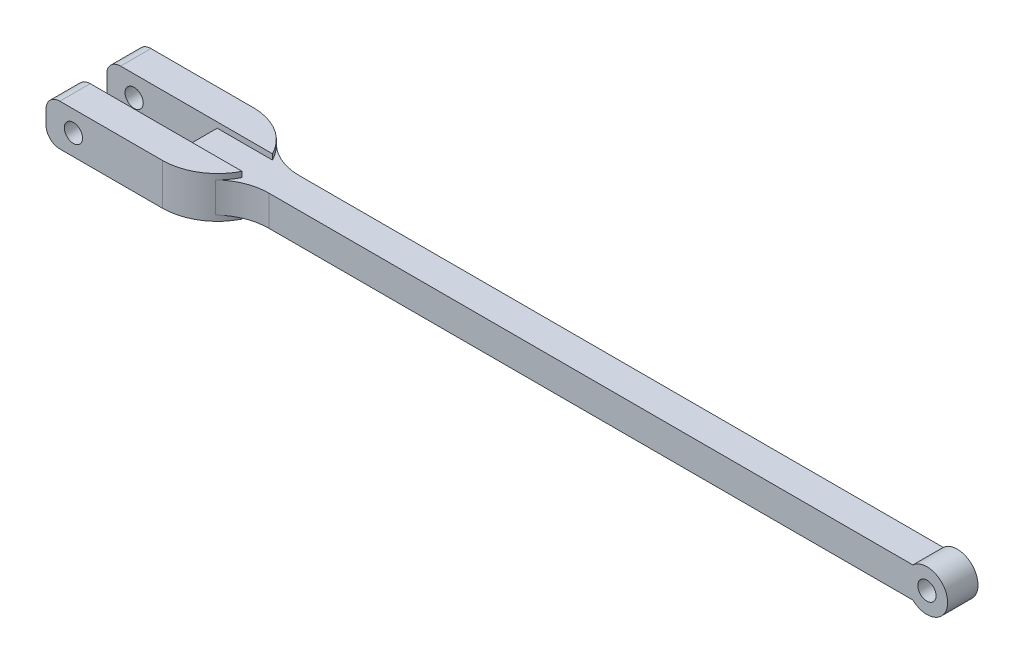
from build123d import *

# Parameters (mm, degrees)
BOSS_EXTRUDE1_DEPTH             = 213.36
BOSS_EXTRUDE1_DEPTH_BACK        = 127
SKETCH1_W                       = 13.97
SKETCH1_H                       = 14.012309452
BOSS_EXTRUDE2_REACH             = 215.589
SKETCH2_R                       = 9.525
BOSS_EXTRUDE2_DIRECTION_2_REACH = 215.589
CUT_EXTRUDE1_DEPTH              = 224.197757773
CUT_EXTRUDE1_DEPTH_BACK         = 224.197757773
SKETCH3_R                       = 4.191
BOSS_EXTRUDE3_DEPTH             = 9.525
FILLET1_R                       = 25.4
FILLET2_R                       = 25.4
FILLET5_R                       = 6.35
CUT_EXTRUDE4_DEPTH              = 225.070437307
CUT_EXTRUDE4_DEPTH_BACK         = 225.070437307
SKETCH10_R                      = 4.191


with BuildPart() as part:
    # Sketch1 → Boss-Extrude1 (new, two sides: drawn at the far end of the back side and taken through both)
    with BuildSketch(Plane(origin=(0, 0, 0), x_dir=(0, 0, -1), z_dir=(1, 0, 0)).offset(-BOSS_EXTRUDE1_DEPTH_BACK)):
        Rectangle(SKETCH1_W, SKETCH1_H)
    extrude(amount=BOSS_EXTRUDE1_DEPTH + BOSS_EXTRUDE1_DEPTH_BACK)

    # Boss-Extrude2: up to this face of the body (flat: up to its plane)
    boss_extrude2_end = Plane(part.part.faces().sort_by_distance((43.18, 0, 6.985))[0])
    # Sketch2 → Boss-Extrude2 (add, up to the picked face)
    with BuildSketch(Plane.XY, mode=Mode.PRIVATE) as boss_extrude2_sk1:
        with Locations((213.36, 0)):
            Circle(SKETCH2_R)
    boss_extrude2_tool1 = split(extrude(boss_extrude2_sk1.sketch, amount=BOSS_EXTRUDE2_REACH, mode=Mode.PRIVATE), bisect_by=boss_extrude2_end, keep=Keep.BOTH, mode=Mode.PRIVATE)
    add(boss_extrude2_tool1.solids().sort_by(Axis((213.36, 0, 0), (0, 0, 1)))[0])

    # Boss-Extrude2 direction 2: up to this face of the body (flat: up to its plane)
    boss_extrude2_direction_2_end = Plane(part.part.faces().sort_by_distance((43.18, 0, -6.985))[0])
    # Sketch2 → Boss-Extrude2 direction 2 (add, up to the picked face)
    with BuildSketch(Plane.XY, mode=Mode.PRIVATE) as boss_extrude2_direction_2_sk1:
        with Locations((213.36, 0)):
            Circle(SKETCH2_R)
    boss_extrude2_direction_2_tool1 = split(extrude(boss_extrude2_direction_2_sk1.sketch, amount=-BOSS_EXTRUDE2_DIRECTION_2_REACH, mode=Mode.PRIVATE), bisect_by=boss_extrude2_direction_2_end, keep=Keep.BOTH, mode=Mode.PRIVATE)
    add(boss_extrude2_direction_2_tool1.solids().sort_by(Axis((213.36, 0, 0), (0, 0, -1)))[0])

    # Sketch3 → Cut-Extrude1 (cut, two sides: drawn at the far end of the back side and taken through both)
    with BuildSketch(Plane.XY.offset(-CUT_EXTRUDE1_DEPTH_BACK)):
        with Locations((213.36, 0)):
            Circle(SKETCH3_R)
    extrude(amount=CUT_EXTRUDE1_DEPTH + CUT_EXTRUDE1_DEPTH_BACK, mode=Mode.SUBTRACT)

    # Sketch6 → Boss-Extrude3 (add, symmetric)
    with BuildSketch(Plane(origin=(0, 0, 0), x_dir=(1, 0, 0), z_dir=(0, 1, 0))):
        with BuildLine():
            Line((-127, 6.985), (-177.8, 6.985))
            Line((-177.8, 6.985), (-177.8, 20.955))
            Line((-177.8, 20.955), (-124.285401687, 20.955))
            ThreePointArc((-124.285401687, 20.955), (-110.964475014, 17.182372768), (-101.6, 6.985))
            Line((-101.6, 6.985), (-127, 6.985))
        make_face()
    boss_extrude3 = extrude(amount=BOSS_EXTRUDE3_DEPTH, both=True)

    # Fillet1
    fillet1_edges = [part.edges().sort_by_distance(p)[0] for p in [
        (-101.6, 0, -6.985),
    ]]
    fillet(fillet1_edges, radius=FILLET1_R)

    # Mirror3: Boss-Extrude3 across plane
    add(boss_extrude3.mirror(Plane.XY))

    # Fillet2
    fillet2_edges = [part.edges().sort_by_distance(p)[0] for p in [
        (-101.6, 0, 6.985),
    ]]
    fillet(fillet2_edges, radius=FILLET2_R)

    # Fillet5
    fillet5_edges = [part.edges().sort_by_distance(p)[0] for p in [
        (-177.8, -9.525, -13.97),
        (-177.8, 9.525, -13.97),
        (-177.8, 9.525, 13.97),
        (-177.8, -9.525, 13.97),
    ]]
    fillet(fillet5_edges, radius=FILLET5_R)

    # Sketch10 → Cut-Extrude4 (cut, two sides: drawn at the far end of the back side and taken through both)
    with BuildSketch(Plane.XY.offset(-CUT_EXTRUDE4_DEPTH_BACK)):
        with Locations((-165.198377534, 0)):
            Circle(SKETCH10_R)
    extrude(amount=CUT_EXTRUDE4_DEPTH + CUT_EXTRUDE4_DEPTH_BACK, mode=Mode.SUBTRACT)


solid = part.part
